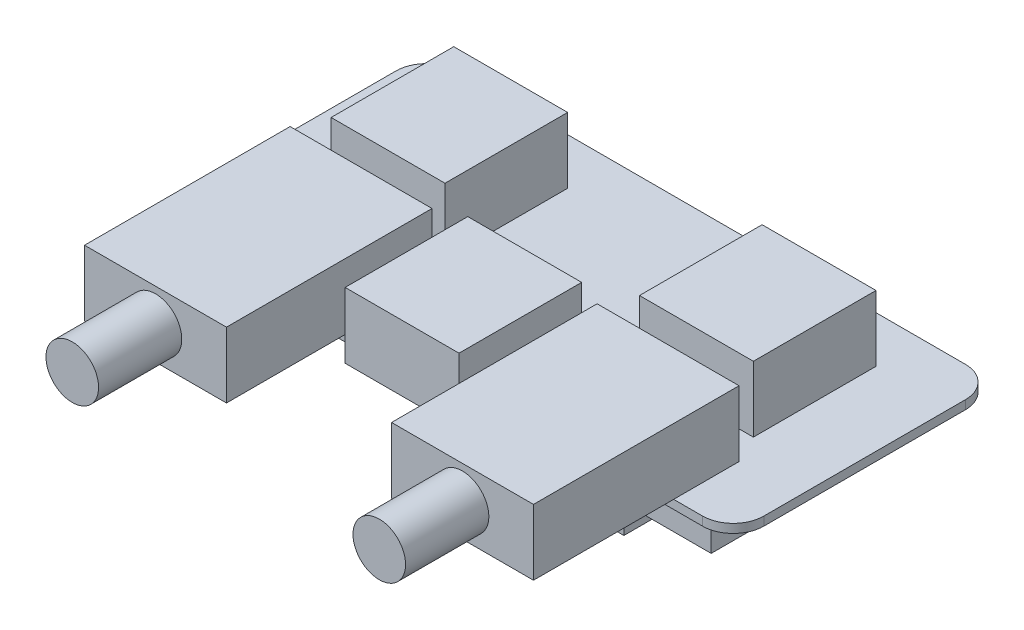
from build123d import *

# Parameters (mm, degrees)
BOSS_EXTRUDE1_DEPTH = 1
SKETCH2_W           = 14
SKETCH2_H           = 13
BOSS_EXTRUDE2_DEPTH = 7.5
SKETCH3_W           = 30
SKETCH3_H           = 20
SKETCH3_W_2         = 10
SKETCH3_H_2         = 11.389779098
BOSS_EXTRUDE3_DEPTH = 4
SKETCH5_W           = 17.510242059
SKETCH5_H           = 17.572802037
BOSS_EXTRUDE4_DEPTH = 4
SKETCH6_W           = 13
SKETCH6_H           = 14
BOSS_EXTRUDE5_DEPTH = 7.5
SKETCH7_W           = 16.2
SKETCH7_H           = 23.463684538
BOSS_EXTRUDE6_DEPTH = 7.5
SKETCH8_R           = 3
BOSS_EXTRUDE7_DEPTH = 9.5


with BuildPart() as part:
    # Sketch1 → Boss-Extrude1 (new body)
    with BuildSketch(Plane(origin=(0, 0, 0), x_dir=(1, 0, 0), z_dir=(0, 1, 0))):
        with BuildLine():
            Line((-29, 30), (29, 30))
            ThreePointArc((29, 30), (31.474873734, 28.974873734), (32.5, 26.5))
            Line((32.5, 26.5), (32.5, 3.5))
            ThreePointArc((32.5, 3.5), (31.474873734, 1.025126266), (29, 0))
            Line((29, 0), (-29, 0))
            ThreePointArc((-29, 0), (-31.474873734, 1.025126266), (-32.5, 3.5))
            Line((-32.5, 3.5), (-32.5, 26.5))
            ThreePointArc((-32.5, 26.5), (-31.474873734, 28.974873734), (-29, 30))
        make_face()
    extrude(amount=BOSS_EXTRUDE1_DEPTH)

    # Sketch2 → Boss-Extrude2 (add)
    with BuildSketch(Plane.XZ):
        with Locations((-18.811596296, -11.8)):
            Rectangle(SKETCH2_W, SKETCH2_H)
    extrude(amount=BOSS_EXTRUDE2_DEPTH)

    # Sketch3 → Boss-Extrude3 (add)
    with BuildSketch(Plane.XZ):
        with Locations((13.188403704, -11.795401308)):
            Rectangle(SKETCH3_W, SKETCH3_H)
        with Locations((-6.811596296, -11.795401308)):
            Rectangle(SKETCH3_W_2, SKETCH3_H_2)
    extrude(amount=BOSS_EXTRUDE3_DEPTH)

    # Sketch5 → Boss-Extrude4 (add)
    with BuildSketch(Plane.XZ.offset(4)):
        with Locations((8.67975542, -11.373546029)):
            Rectangle(SKETCH5_W, SKETCH5_H)
    extrude(amount=BOSS_EXTRUDE4_DEPTH)

    # Sketch6 → Boss-Extrude5 (add)
    with BuildSketch(Plane(origin=(0, 1, 0), x_dir=(1, 0, 0), z_dir=(0, 1, 0))):
        with Locations((0, 1.7)):
            Rectangle(SKETCH6_W, SKETCH6_H)
        with Locations((-17.6, 17.7)):
            Rectangle(SKETCH6_W, SKETCH6_H)
        with Locations((17.6, 17.7)):
            Rectangle(SKETCH6_W, SKETCH6_H)
    extrude(amount=BOSS_EXTRUDE5_DEPTH)

    # Sketch7 → Boss-Extrude6 (add)
    with BuildSketch(Plane(origin=(0, 1, 0), x_dir=(1, 0, 0), z_dir=(0, 1, 0))):
        with Locations((-17.444739374, -4.268157731)):
            Rectangle(SKETCH7_W, SKETCH7_H)
        with Locations((17.6, -4.268157731)):
            Rectangle(SKETCH7_W, SKETCH7_H)
    extrude(amount=BOSS_EXTRUDE6_DEPTH)

    # Sketch8 → Boss-Extrude7 (add)
    with BuildSketch(Plane.XY.offset(16)):
        with Locations(Location((-17.444739374, 4.75, 0), (0, 0, 180))):
            Circle(SKETCH8_R)
        with Locations(Location((17.6, 4.75, 0), (0, 0, 180))):
            Circle(SKETCH8_R)
    extrude(amount=BOSS_EXTRUDE7_DEPTH)


solid = part.part
